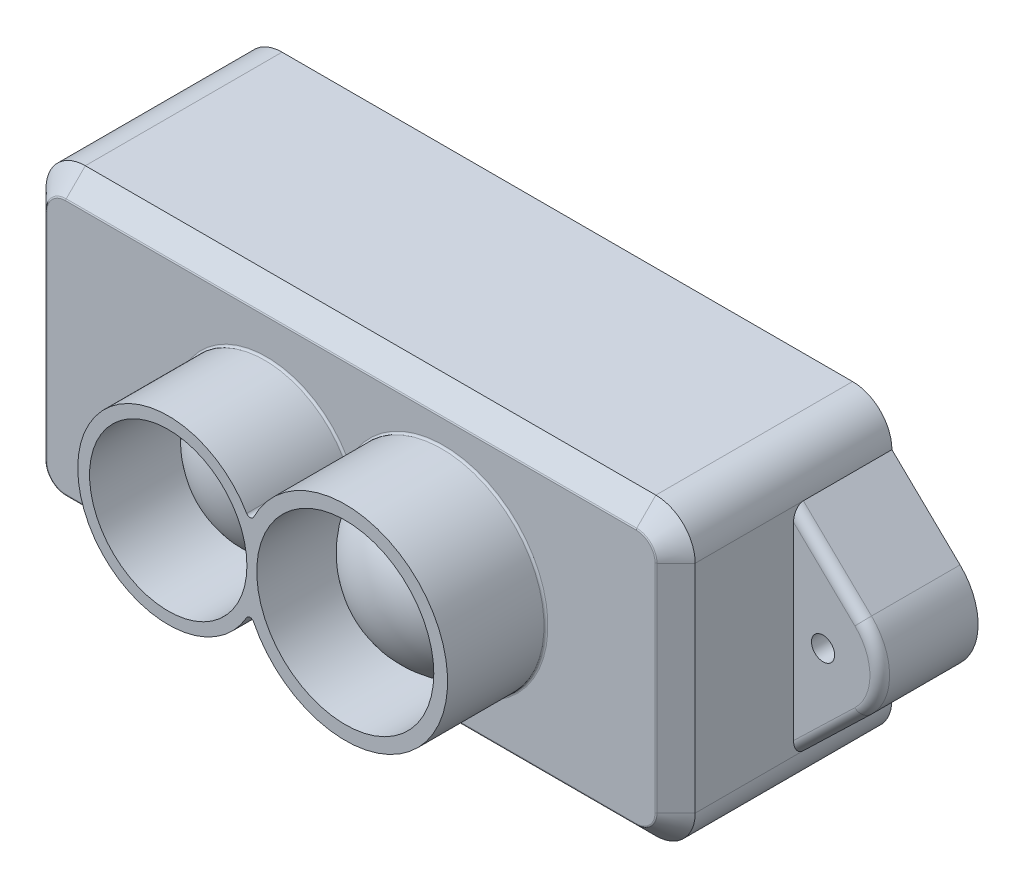
from build123d import *

# Parameters (mm, degrees)
BOSS_EXTRU_1_DEPTH      = 11
ESQUISSE2_R             = 0.5875
BOSS_EXTRU_2_DEPTH      = 5
ESQUISSE3_R             = 4.5
ESQUISSE3_R_2           = 4
BOSS_EXTRU_3_DEPTH      = 5
CHANFREIN1_SIZE         = 1
CONG_3_R                = 0.5
CONG_4_R                = 0.1
ENL_V_MAT_EXTRU_1_DEPTH = 6


with BuildPart() as part:
    # Esquisse1 → Boss.-Extru.1 (new body)
    with BuildSketch(Plane.XY):
        with BuildLine():
            Line((-14.5, 7.5), (14.5, 7.5))
            ThreePointArc((14.5, 7.5), (15.914213562, 6.914213562), (16.5, 5.5))
            Line((16.5, 5.5), (16.5, -5.5))
            ThreePointArc((16.5, -5.5), (15.914213562, -6.914213562), (14.5, -7.5))
            Line((14.5, -7.5), (-14.5, -7.5))
            ThreePointArc((-14.5, -7.5), (-15.914213562, -6.914213562), (-16.5, -5.5))
            Line((-16.5, -5.5), (-16.5, 5.5))
            ThreePointArc((-16.5, 5.5), (-15.914213562, 6.914213562), (-14.5, 7.5))
        make_face()
    extrude(amount=BOSS_EXTRU_1_DEPTH)

    # Esquisse2 → Boss.-Extru.2 (add)
    with BuildSketch(Plane(origin=(0, 0, 0), x_dir=(-1, 0, 0), z_dir=(0, 0, -1))):
        with BuildLine():
            Line((16.5, 5.5), (19.964184984, 2.159531519))
            ThreePointArc((19.964184984, 2.159531519), (20.881776854, 0), (19.964184984, -2.159531519))
            Line((19.964184984, -2.159531519), (16.5, -5.5))
            Line((16.5, -5.5), (16.5, 5.5))
        make_face()
        with Locations((18, 0)):
            Circle(ESQUISSE2_R, mode=Mode.SUBTRACT)
    boss_extru_2 = extrude(amount=-BOSS_EXTRU_2_DEPTH)

    # Symétrie1: Boss.-Extru.2 across plane
    add(boss_extru_2.mirror(Plane(origin=(0, 0, 0), x_dir=(0, 0, 1), z_dir=(1, 0, 0))))

    # Esquisse3 → Boss.-Extru.3 (add)
    with BuildSketch(Plane.XY.offset(11)):
        with BuildLine():
            ThreePointArc((-0.299832182, 2.294883197), (-8.886498849, 0), (-0.299832182, -2.294883197))
            ThreePointArc((-0.299832182, -2.294883197), (-0.120213455, -2.194759517), (0.05276041, -2.305969589))
            ThreePointArc((0.05276041, -2.305969589), (9.913501151, 0), (0.05276041, 2.305969589))
            ThreePointArc((0.05276041, 2.305969589), (-0.120213455, 2.194759517), (-0.299832182, 2.294883197))
        make_face()
        with Locations((4.713501151, 0)):
            Circle(ESQUISSE3_R, mode=Mode.SUBTRACT)
        with Locations((-4.286498849, 0)):
            Circle(ESQUISSE3_R_2, mode=Mode.SUBTRACT)
    extrude(amount=BOSS_EXTRU_3_DEPTH)

    # Chanfrein1
    chanfrein1_edges = [part.edges().sort_by_distance(p)[0] for p in [
        (15.914213562, -6.914213562, 11),
        (16.5, 0, 11),
        (15.914213562, 6.914213562, 11),
        (0, 7.5, 11),
        (-15.914213562, 6.914213562, 11),
        (-16.5, 0, 11),
        (-15.914213562, -6.914213562, 11),
        (0, -7.5, 11),
    ]]
    chamfer(chanfrein1_edges, length=CHANFREIN1_SIZE)

    # Congé3
    cong_3_edges = [part.edges().sort_by_distance(p)[0] for p in [
        (-18.232092492, 3.829765759, 5),
        (-20.881776854, 0, 5),
        (-18.232092492, -3.829765759, 5),
        (18.232092492, -3.829765759, 5),
        (20.881776854, 0, 5),
        (18.232092492, 3.829765759, 5),
    ]]
    fillet(cong_3_edges, radius=CONG_3_R)

    # Congé4
    cong_4_edges = [part.edges().sort_by_distance(p)[0] for p in [
        (-0.120213455, -2.194759517, 11),
        (9.913501151, 0, 11),
        (-0.120213455, 2.194759517, 11),
        (-8.886498849, 0, 11),
        (-15.5, 0, 11),
        (-15.207106781, -6.207106781, 11),
        (-15.207106781, 6.207106781, 11),
        (0, -6.5, 11),
        (0, 6.5, 11),
        (15.207106781, -6.207106781, 11),
        (15.207106781, 6.207106781, 11),
        (15.5, 0, 11),
    ]]
    fillet(cong_4_edges, radius=CONG_4_R)

    # Esquisse6 → Enlèv. mat.-Extru.1 (cut)
    with BuildSketch(Plane(origin=(0, 0, 0), x_dir=(-1, 0, 0), z_dir=(0, 0, -1))):
        with BuildLine():
            Line((-15.432881985, 5.13981782), (-15.432881985, -5.13981782))
            ThreePointArc((-15.432881985, -5.13981782), (-15.324676355, -6.065604906), (-14.5, -6.5))
            Line((-14.5, -6.5), (14.5, -6.5))
            ThreePointArc((14.5, -6.5), (15.324676355, -6.065604906), (15.432881985, -5.13981782))
            Line((15.432881985, -5.13981782), (15.432881985, 5.13981782))
            ThreePointArc((15.432881985, 5.13981782), (15.324676355, 6.065604906), (14.5, 6.5))
            Line((14.5, 6.5), (-14.5, 6.5))
            ThreePointArc((-14.5, 6.5), (-15.324676355, 6.065604906), (-15.432881985, 5.13981782))
        make_face()
    extrude(amount=-ENL_V_MAT_EXTRU_1_DEPTH, mode=Mode.SUBTRACT)


with BuildPart() as body_2:
    # Esquisse8 → Révolution2 (revolve)
    with BuildSketch(Plane(origin=(0, 0, 0), x_dir=(1, 0, 0), z_dir=(0, 1, 0))):
        with BuildLine():
            Line((4.713501151, -11.1), (0.213501151, -11.1))
            ThreePointArc((0.213501151, -11.1), (1.884860928, -13.573739635), (4.713501151, -14.528530595))
            Line((4.713501151, -14.528530595), (4.713501151, -11.1))
        make_face()
    revolve(axis=Axis((4.713501151, 0, 16), (0, 0, -1)))


with BuildPart() as body_3:
    # Esquisse9 → Révolution3 (revolve)
    with BuildSketch(Plane(origin=(0, 0, 0), x_dir=(1, 0, 0), z_dir=(0, 1, 0))):
        with BuildLine():
            Line((-8.286498849, -11.1), (-4.286498849, -11.1))
            Line((-4.286498849, -11.1), (-4.286498849, -13.501533111))
            ThreePointArc((-4.286498849, -13.501533111), (-6.619274089, -12.855037889), (-8.286498849, -11.1))
        make_face()
    revolve(axis=Axis((-4.286498849, 0, 16), (0, 0, -1)))


solid = Compound([part.part, body_2.part, body_3.part])
